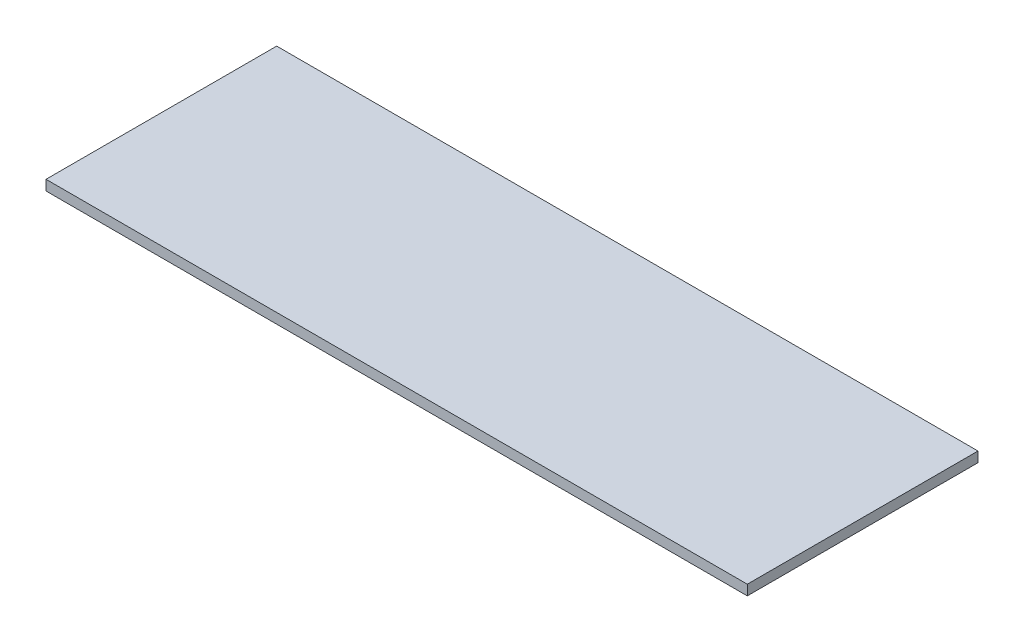
from build123d import *

# Parameters (mm, degrees)
SKETCH_1_W      = 76
SKETCH_1_H      = 25
EXTRUDE_1_DEPTH = 1.1


with BuildPart() as part:
    # 草图1 → 凸台-拉伸1 (new body)
    with BuildSketch(Plane(origin=(0, 0, 0), x_dir=(1, 0, 0), z_dir=(0, 1, 0))):
        Rectangle(SKETCH_1_W, SKETCH_1_H)
    extrude(amount=EXTRUDE_1_DEPTH)


solid = part.part
